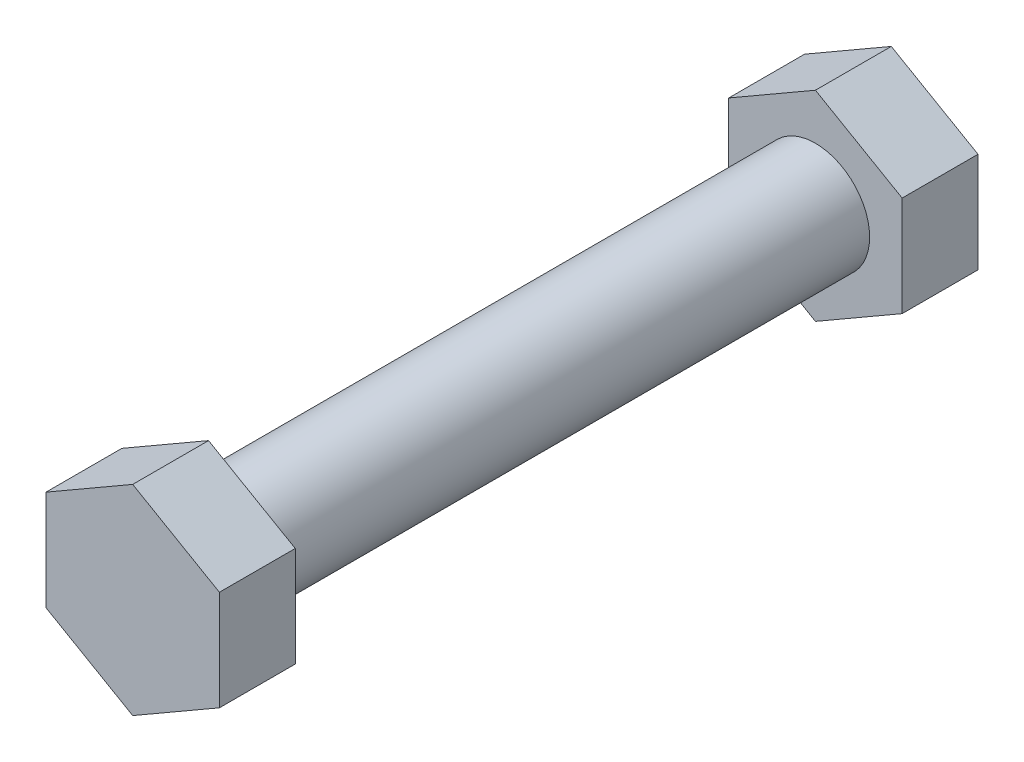
from build123d import *

# Parameters (mm, degrees)
EXTRUDE_START      = -33
EXTRUDE_SKETCH_1_R = 5
EXTRUDE_1_DEPTH    = 66
EXTRUDE_START_2    = 28
EXTRUDE_2_DEPTH    = 7
EXTRUDE_START_3    = -35
EXTRUDE_3_DEPTH    = 7


with BuildPart() as part:
    # Extrude sketch 1 → Extrude 1 (new body)
    with BuildSketch(Plane.XY.offset(EXTRUDE_START)):
        Circle(EXTRUDE_SKETCH_1_R)
    extrude(amount=EXTRUDE_1_DEPTH)


with BuildPart() as body_2:
    # Extrude sketch 2 → Extrude 2 (new body)
    with BuildSketch(Plane.XY.offset(EXTRUDE_START_2)):
        Polygon((8, 4.618802154), (0, 9.237604307), (-8, 4.618802154), (-8, -4.618802154), (0, -9.237604307), (8, -4.618802154), align=None)
    extrude(amount=EXTRUDE_2_DEPTH)


with BuildPart() as body_3:
    # Extrude sketch 3 → Extrude 3 (new body)
    with BuildSketch(Plane.XY.offset(EXTRUDE_START_3)):
        Polygon((8, 4.618802154), (0, 9.237604307), (-8, 4.618802154), (-8, -4.618802154), (0, -9.237604307), (8, -4.618802154), align=None)
    extrude(amount=EXTRUDE_3_DEPTH)

    # Combine (weld / assembly of features): union body 2, part
    add(body_2.part)
    add(part.part)


solid = body_3.part
